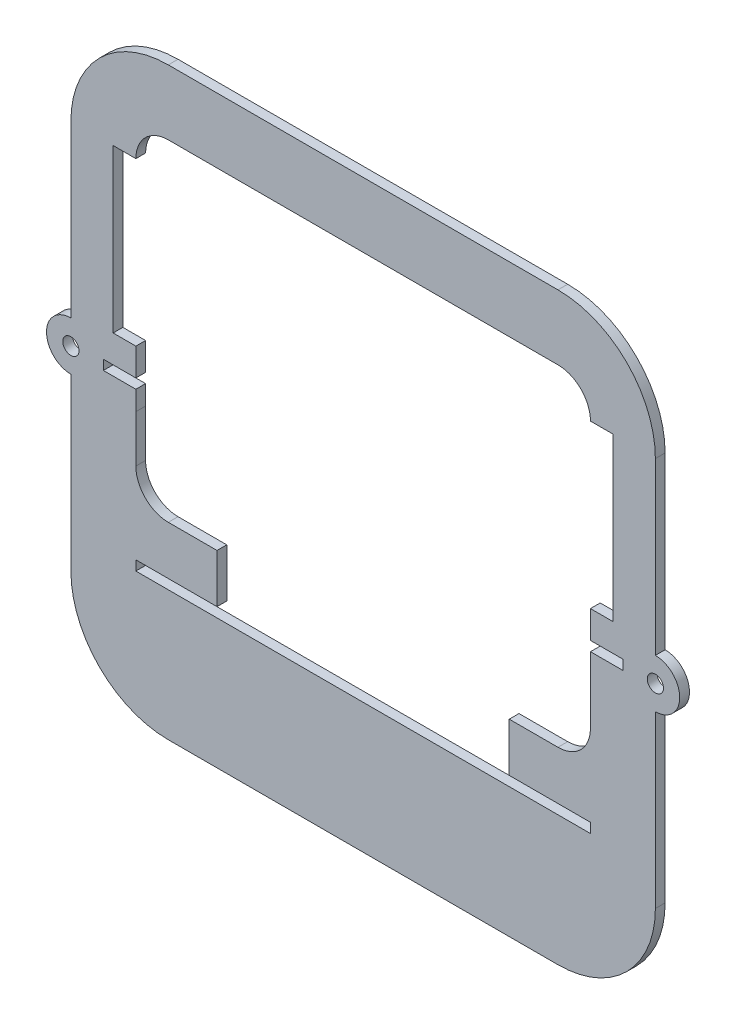
from build123d import *

# Parameters (mm, degrees)
SKETCH1_R           = 2.5
BOSS_EXTRUDE1_DEPTH = 3


with BuildPart() as part:
    # Sketch1 → Boss-Extrude1 (new body)
    with BuildSketch(Plane.XY):
        with BuildLine():
            Line((167.77621964, -174.96032759), (287.77621964, -174.96032759))
            ThreePointArc((287.77621964, -174.96032759), (308.989423075, -166.173531026), (317.77621964, -144.96032759))
            Line((317.77621964, -144.96032759), (317.77621964, -92.46032759))
            ThreePointArc((317.77621964, -92.46032759), (325.27621964, -84.96032759), (317.77621964, -77.46032759))
            Line((317.77621964, -77.46032759), (317.77621964, -24.96032759))
            ThreePointArc((317.77621964, -24.96032759), (308.989423075, -3.747124154), (287.77621964, 5.03967241))
            Line((287.77621964, 5.03967241), (167.77621964, 5.03967241))
            ThreePointArc((167.77621964, 5.03967241), (146.563016204, -3.747124154), (137.77621964, -24.96032759))
            Line((137.77621964, -24.96032759), (137.77621964, -77.46032759))
            ThreePointArc((137.77621964, -77.46032759), (130.27621964, -84.96032759), (137.77621964, -92.46032759))
            Line((137.77621964, -92.46032759), (137.77621964, -144.96032759))
            ThreePointArc((137.77621964, -144.96032759), (146.563016204, -166.173531026), (167.77621964, -174.96032759))
        make_face()
        with Locations((317.77621964, -84.96032759)):
            Circle(SKETCH1_R, mode=Mode.SUBTRACT)
        with Locations((137.77621964, -84.96032759)):
            Circle(SKETCH1_R, mode=Mode.SUBTRACT)
        with BuildLine():
            Line((226.284678956, -14.96032759), (167.784678956, -14.96032759))
            ThreePointArc((167.784678956, -14.96032759), (160.713611144, -17.889259778), (157.784678956, -24.96032759))
            Line((157.784678956, -24.96032759), (150.784678956, -24.96032759))
            Line((150.784678956, -24.96032759), (150.784678956, -74.96032759))
            Line((150.784678956, -74.96032759), (157.784678956, -74.96032759))
            Line((157.784678956, -74.96032759), (157.784678956, -83.46032759))
            Line((157.784678956, -83.46032759), (147.784678956, -83.46032759))
            Line((147.784678956, -83.46032759), (147.784678956, -86.46032759))
            Line((147.784678956, -86.46032759), (157.784678956, -86.46032759))
            Line((157.784678956, -86.46032759), (157.77621964, -92.46032759))
            Line((157.77621964, -92.46032759), (157.77621964, -106.96032759))
            ThreePointArc((157.77621964, -106.96032759), (160.705151828, -114.031395402), (167.77621964, -116.96032759))
            Line((167.77621964, -116.96032759), (182.77621964, -116.96032759))
            Line((182.77621964, -116.96032759), (182.77621964, -131.96032759))
            Line((182.77621964, -131.96032759), (157.77621964, -131.96032759))
            Line((157.77621964, -131.96032759), (157.77621964, -134.96032759))
            Line((157.77621964, -134.96032759), (297.77621964, -134.96032759))
            Line((297.77621964, -134.96032759), (297.77621964, -131.96032759))
            Line((297.77621964, -131.96032759), (272.77621964, -131.96032759))
            Line((272.77621964, -131.96032759), (272.77621964, -116.96032759))
            Line((272.77621964, -116.96032759), (287.77621964, -116.96032759))
            ThreePointArc((287.77621964, -116.96032759), (294.847287452, -114.031395402), (297.77621964, -106.96032759))
            Line((297.77621964, -106.96032759), (297.77621964, -92.46032759))
            Line((297.77621964, -92.46032759), (297.784678956, -86.46032759))
            Line((297.784678956, -86.46032759), (307.784678956, -86.46032759))
            Line((307.784678956, -86.46032759), (307.784678956, -83.46032759))
            Line((307.784678956, -83.46032759), (297.784678956, -83.46032759))
            Line((297.784678956, -83.46032759), (297.784678956, -74.96032759))
            Line((297.784678956, -74.96032759), (304.784678956, -74.96032759))
            Line((304.784678956, -74.96032759), (304.784678956, -24.96032759))
            Line((304.784678956, -24.96032759), (297.784678956, -24.96032759))
            ThreePointArc((297.784678956, -24.96032759), (294.855746768, -17.889259778), (287.784678956, -14.96032759))
            Line((287.784678956, -14.96032759), (229.284678956, -14.96032759))
            Line((229.284678956, -14.96032759), (226.284678956, -14.96032759))
        make_face(mode=Mode.SUBTRACT)
    extrude(amount=BOSS_EXTRUDE1_DEPTH)


solid = part.part
